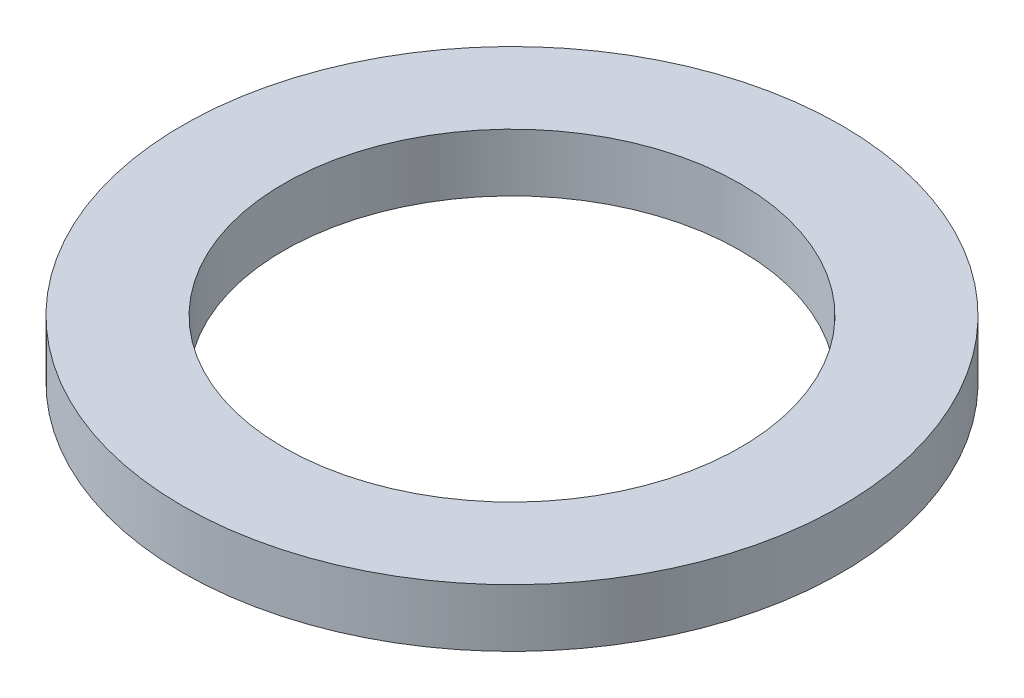
from build123d import *

# Parameters (mm, degrees)
SKETCH2_R           = 11.4
SKETCH2_R_2         = 7.9
BOSS_EXTRUDE1_DEPTH = 2


with BuildPart() as part:
    # Sketch2 → Boss-Extrude1 (new body)
    with BuildSketch(Plane(origin=(0, 0, 0), x_dir=(1, 0, 0), z_dir=(0, 1, 0))):
        with Locations(Location((0, 0, 0), (0, 0, 270))):
            Circle(SKETCH2_R)
        with Locations(Location((0, 0, 0), (0, 0, 270))):
            Circle(SKETCH2_R_2, mode=Mode.SUBTRACT)
    extrude(amount=BOSS_EXTRUDE1_DEPTH)


solid = part.part
